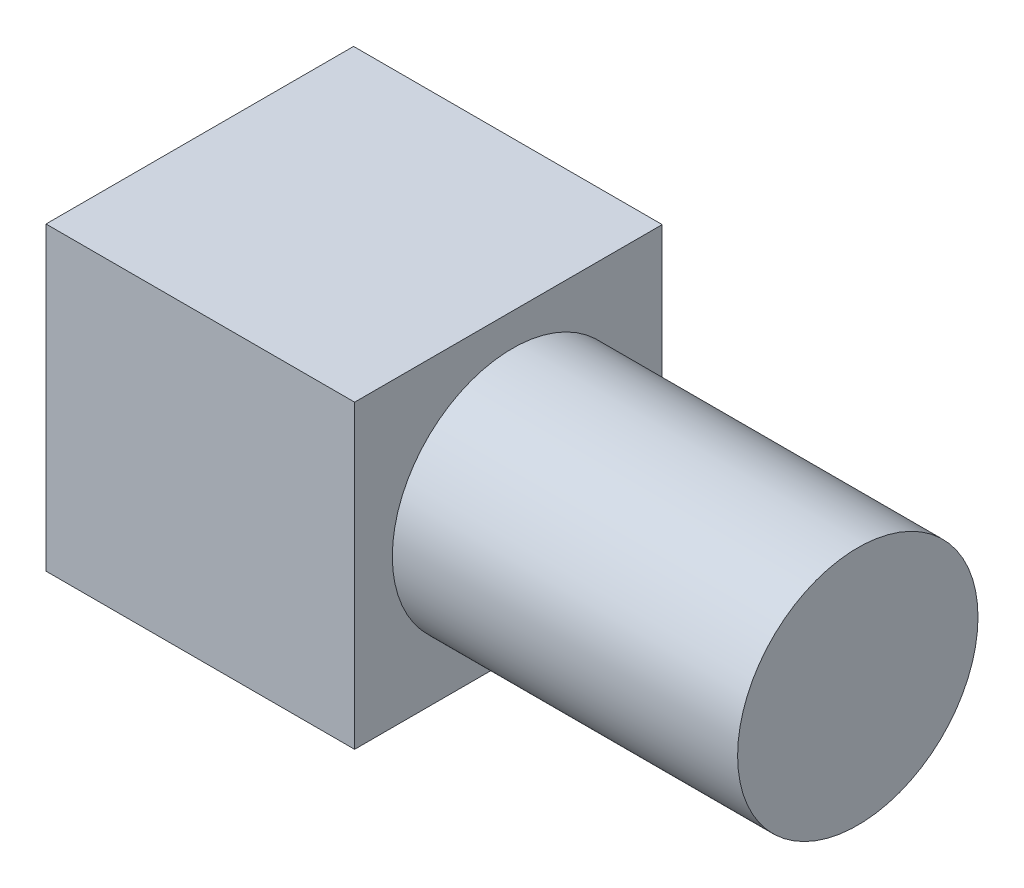
from build123d import *

# Parameters (mm, degrees)
SKETCH1_W           = 74.927464823
SKETCH1_H           = 74.675183796
BOSS_EXTRUDE1_DEPTH = 73
SKETCH2_R           = 29.181851702
BOSS_EXTRUDE2_DEPTH = 103
SCALE1_SCALE        = 0.18


with BuildPart() as part:
    # Sketch1 → Boss-Extrude1 (new body)
    with BuildSketch(Plane(origin=(0, 0, 0), x_dir=(1, 0, 0), z_dir=(0, 1, 0))):
        with Locations((-18.29037441, -13.370894396)):
            Rectangle(SKETCH1_W, SKETCH1_H)
    extrude(amount=BOSS_EXTRUDE1_DEPTH)

    # Sketch2 → Boss-Extrude2 (add)
    with BuildSketch(Plane(origin=(0, 0, 0), x_dir=(0, 0, -1), z_dir=(1, 0, 0))):
        with Locations(Location((-12.372124572, 35.974241577, 0), (0, 0, 180))):
            Circle(SKETCH2_R)
    extrude(amount=BOSS_EXTRUDE2_DEPTH)


with BuildPart() as part_1:
    # Scale1: scaled about (9.844501825, 36.313647049, 13.016884463)
    add(part.part.scale(SCALE1_SCALE).moved(Location((8.072491497, 29.77719058, 10.67384526))))


solid = part_1.part
